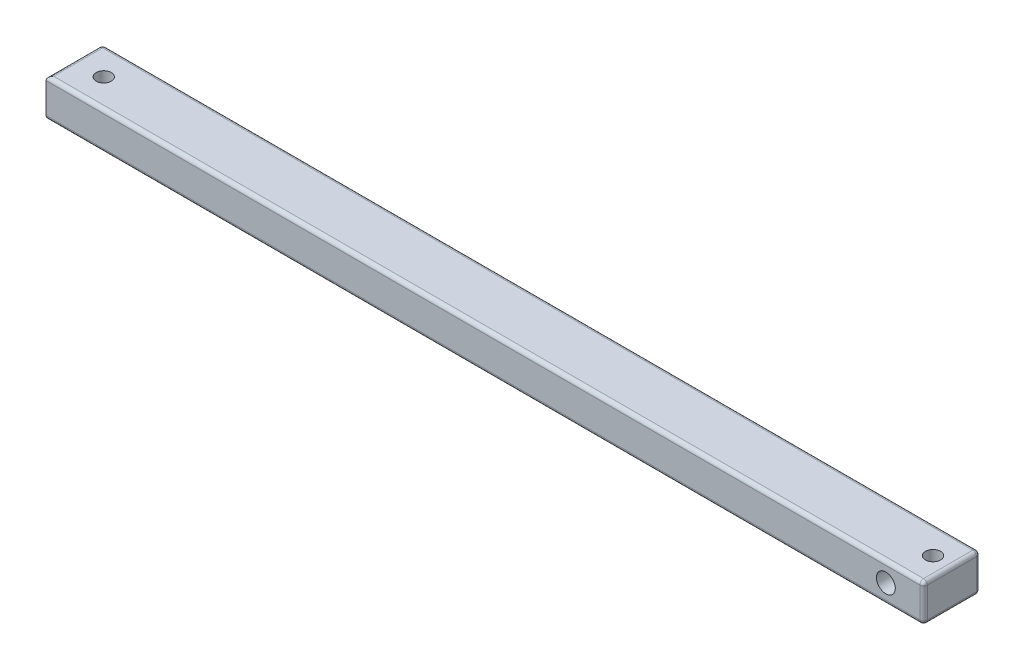
from build123d import *

# Parameters (mm, degrees)
SKETCH1_W           = 465
SKETCH1_H           = 20
BOSS_EXTRUDE1_DEPTH = 30
FILLET1_R           = 2
SKETCH3_R           = 4
CUT_EXTRUDE2_DEPTH  = 236.279089594
SKETCH5_R           = 5
CUT_EXTRUDE4_DEPTH  = 236.279089594
SKETCH8_R           = 4
CUT_EXTRUDE5_DEPTH  = 236.279089594


with BuildPart() as part:
    # Sketch1 → Boss-Extrude1 (new body)
    with BuildSketch(Plane.XY):
        with Locations((0, 10)):
            Rectangle(SKETCH1_W, SKETCH1_H)
    extrude(amount=BOSS_EXTRUDE1_DEPTH)

    # Fillet1
    fillet1_edges = [part.edges().sort_by_distance(p)[0] for p in [
        (232.5, 10, 30),
        (0, 20, 30),
        (0, 20, 0),
        (232.5, 10, 0),
        (0, 0, 0),
        (-232.5, 10, 0),
        (-232.5, 20, 15),
        (232.5, 20, 15),
        (232.5, 0, 15),
        (-232.5, 0, 15),
        (0, 0, 30),
    ]]
    fillet(fillet1_edges, radius=FILLET1_R)

    # Sketch3 → Cut-Extrude2 (cut, through all)
    with BuildSketch(Plane(origin=(0, 20, 0), x_dir=(1, 0, 0), z_dir=(0, 1, 0))):
        with Locations(Location((-216.9, -15, 0), (0, 0, 270))):
            Circle(SKETCH3_R)
    extrude(amount=-CUT_EXTRUDE2_DEPTH, mode=Mode.SUBTRACT)

    # Sketch5 → Cut-Extrude4 (cut, through all)
    with BuildSketch(Plane.XY.offset(30)):
        with Locations((212.5, 10)):
            Circle(SKETCH5_R)
    extrude(amount=-CUT_EXTRUDE4_DEPTH, mode=Mode.SUBTRACT)

    # Sketch8 → Cut-Extrude5 (cut, through all)
    with BuildSketch(Plane(origin=(0, 20, 0), x_dir=(1, 0, 0), z_dir=(0, 1, 0))):
        with Locations(Location((222.5, -15, 0), (0, 0, 270))):
            Circle(SKETCH8_R)
    extrude(amount=-CUT_EXTRUDE5_DEPTH, mode=Mode.SUBTRACT)


solid = part.part
